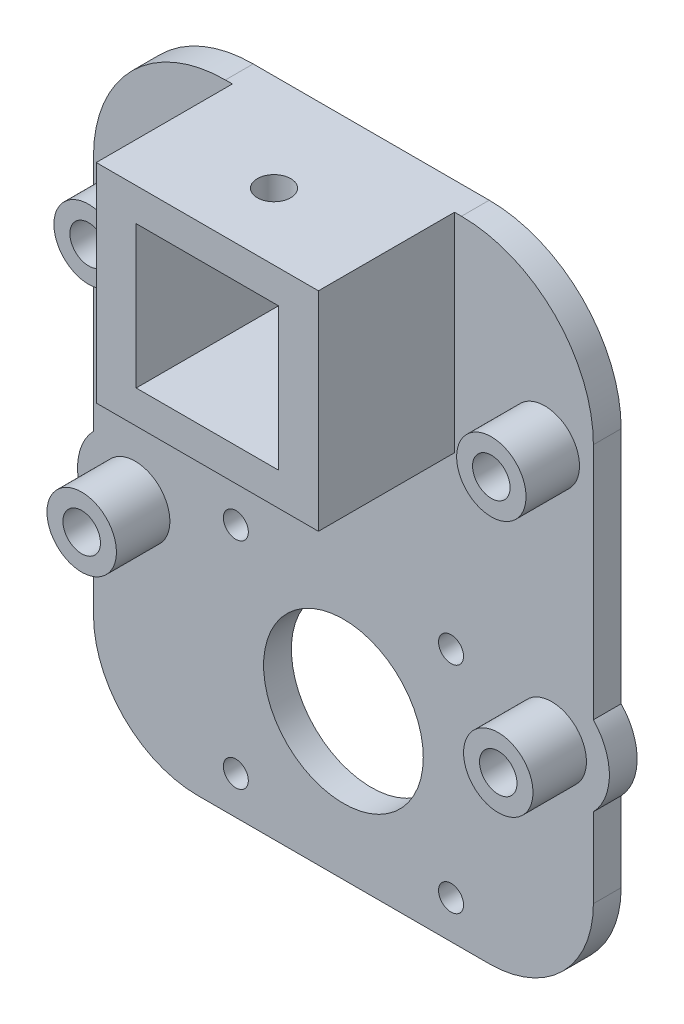
from build123d import *

# Parameters (mm, degrees)
SKETCH_1_R          = 1.8
SKETCH_1_R_2        = 11.5
SKETCH_1_R_3        = 2.7
SKETCH_1_W          = 20.5
SKETCH_1_H          = 20.5
EXTRUDE_1_DEPTH     = 4
EXTRUDE_START       = 4
SKETCH_1_4_W        = 32
SKETCH_1_4_H        = 30
SKETCH_1_4_W_2      = 20.5
SKETCH_1_4_H_2      = 20.5
SKETCH_1_4_R        = 1.6
EXTRUDE_3_DEPTH     = 19.6
CUT_EXTRUDE_4_REACH = 103.737
SKETCH_8_R          = 2.4
SKETCH_9_R          = 5
SKETCH_9_R_2        = 2.7
EXTRUDE_4_DEPTH     = 7.7


with BuildPart() as part:
    # 草图1 → 凸台-拉伸1 (new body)
    with BuildSketch(Plane.XY):
        with BuildLine():
            ThreePointArc((-36, -25.5), (-31.606601718, -36.106601718), (-21, -40.5))
            Line((-21, -40.5), (21, -40.5))
            ThreePointArc((21, -40.5), (31.606601718, -36.106601718), (36, -25.5))
            Line((36, -25.5), (36, -14.034980384))
            ThreePointArc((36, -14.034980384), (38.3, -8.3), (36, -2.565019616))
            Line((36, -2.565019616), (36, 31.75))
            ThreePointArc((36, 31.75), (30.435028843, 45.185028843), (17, 50.75))
            Line((17, 50.75), (-17, 50.75))
            ThreePointArc((-17, 50.75), (-30.435028843, 45.185028843), (-36, 31.75))
            Line((-36, 31.75), (-36, -2.565019616))
            ThreePointArc((-36, -2.565019616), (-38.3, -8.3), (-36, -14.034980384))
            Line((-36, -14.034980384), (-36, -25.5))
        make_face()
        with Locations((15.5, -35)):
            Circle(SKETCH_1_R, mode=Mode.SUBTRACT)
        with Locations((0, -19.5)):
            Circle(SKETCH_1_R_2, mode=Mode.SUBTRACT)
        with Locations((15.5, -4)):
            Circle(SKETCH_1_R, mode=Mode.SUBTRACT)
        with Locations((-15.5, -35)):
            Circle(SKETCH_1_R, mode=Mode.SUBTRACT)
        with Locations((-15.5, -4)):
            Circle(SKETCH_1_R, mode=Mode.SUBTRACT)
        with Locations((-30, -8.3)):
            Circle(SKETCH_1_R_3, mode=Mode.SUBTRACT)
        with Locations((30, -8.3)):
            Circle(SKETCH_1_R_3, mode=Mode.SUBTRACT)
        with Locations((-29, 28.1)):
            Circle(SKETCH_1_R_3, mode=Mode.SUBTRACT)
        with Locations((29, 28.1)):
            Circle(SKETCH_1_R_3, mode=Mode.SUBTRACT)
        with Locations((0, 35.75)):
            Rectangle(SKETCH_1_W, SKETCH_1_H, mode=Mode.SUBTRACT)
    extrude(amount=EXTRUDE_1_DEPTH)

    # 草图1<4> → 凸台-拉伸3 (add)
    # profile 1 of 3: a face of its own
    with BuildSketch(Plane.XY.offset(EXTRUDE_START)):
        with Locations((0, 35.75)):
            Rectangle(SKETCH_1_4_W, SKETCH_1_4_H)
        with Locations((0, 35.75)):
            Rectangle(SKETCH_1_4_W_2, SKETCH_1_4_H_2, mode=Mode.SUBTRACT)
    # profile 2 of 3: a face of its own
    with BuildSketch(Plane.XY.offset(EXTRUDE_START)):
        with Locations((-13.2, 35.75)):
            Circle(SKETCH_1_4_R)
    # profile 3 of 3: a face of its own
    with BuildSketch(Plane.XY.offset(EXTRUDE_START)):
        with Locations((13.2, 35.75)):
            Circle(SKETCH_1_4_R)
    extrude(amount=EXTRUDE_3_DEPTH)

    # 草图8 → 切除-拉伸4 (cut, up to next)
    with BuildSketch(Plane(origin=(0, 50.75, 0), x_dir=(1, 0, 0), z_dir=(0, 1, 0)), mode=Mode.PRIVATE) as cut_extrude_4_sk1:
        with Locations(Location((0, -14, 0), (0, 0, 270))):
            Circle(SKETCH_8_R)
    cut_extrude_4_tool1 = extrude(cut_extrude_4_sk1.sketch, amount=-CUT_EXTRUDE_4_REACH, mode=Mode.PRIVATE) & part.part
    add(cut_extrude_4_tool1.solids().sort_by_distance((0, 50.75, 14))[0], mode=Mode.SUBTRACT)

    # 草图9 → 凸台-拉伸4 (add)
    # profile 1 of 4: a face of its own
    with BuildSketch(Plane.XY.offset(4)):
        with Locations(Location((-29, 28.1, 0), (0, 0, 180))):
            Circle(SKETCH_9_R)
        with Locations((-29, 28.1)):
            Circle(SKETCH_9_R_2, mode=Mode.SUBTRACT)
    # profile 2 of 4: a face of its own
    with BuildSketch(Plane.XY.offset(4)):
        with Locations(Location((-30, -8.3, 0), (0, 0, 180))):
            Circle(SKETCH_9_R)
        with Locations((-30, -8.3)):
            Circle(SKETCH_9_R_2, mode=Mode.SUBTRACT)
    # profile 3 of 4: a face of its own
    with BuildSketch(Plane.XY.offset(4)):
        with Locations(Location((30, -8.3, 0), (0, 0, 180))):
            Circle(SKETCH_9_R)
        with Locations(Location((30, -8.3, 0), (0, 0, 180))):
            Circle(SKETCH_9_R_2, mode=Mode.SUBTRACT)
    # profile 4 of 4: a face of its own
    with BuildSketch(Plane.XY.offset(4)):
        with Locations(Location((29, 28.1, 0), (0, 0, 180))):
            Circle(SKETCH_9_R)
        with Locations(Location((29, 28.1, 0), (0, 0, 180))):
            Circle(SKETCH_9_R_2, mode=Mode.SUBTRACT)
    extrude(amount=EXTRUDE_4_DEPTH)


solid = part.part
